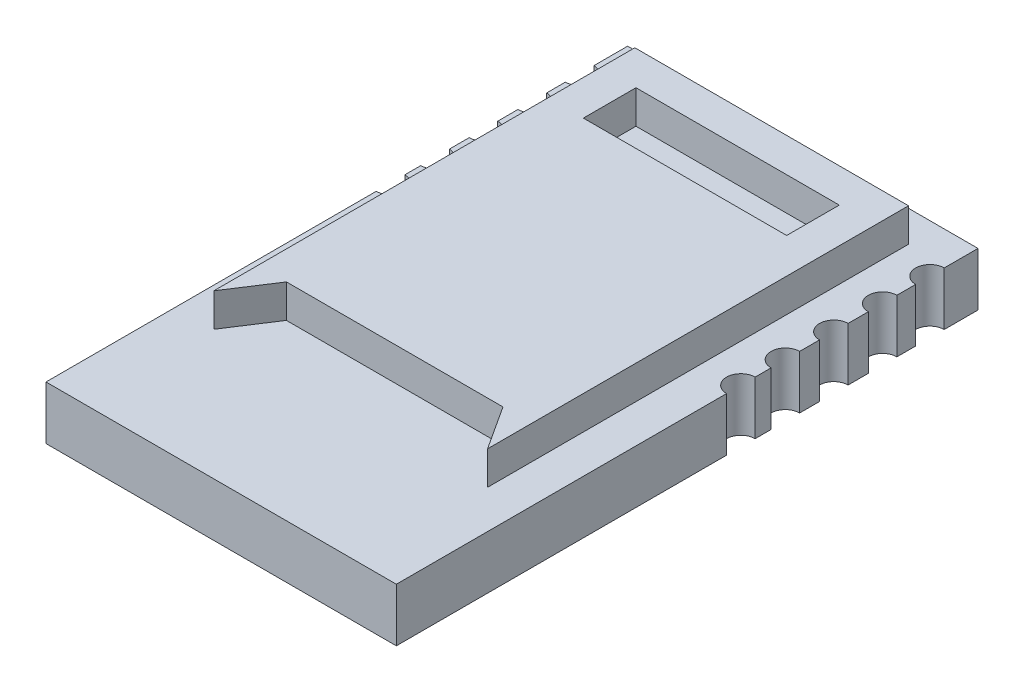
from build123d import *

# Parameters (mm, degrees)
BOSS_EXTRUDE1_DEPTH = 8
SKETCH2_W           = 30.471838297
SKETCH2_H           = 7.887355033
BOSS_EXTRUDE2_DEPTH = 13


with BuildPart() as part:
    # Sketch1 → Boss-Extrude1 (new body)
    with BuildSketch(Plane(origin=(0, 0, 0), x_dir=(1, 0, 0), z_dir=(0, 1, 0))):
        with BuildLine():
            Line((5.74475938, 41.611912647), (-46.770116697, 41.611912647))
            Line((-46.770116697, 41.611912647), (-46.770116697, 36.54735623))
            ThreePointArc((-46.770116697, 36.54735623), (-44.629147114, 34.406386647), (-46.770116697, 32.265417064))
            Line((-46.770116697, 32.265417064), (-46.770116697, 29.455346126))
            ThreePointArc((-46.770116697, 29.455346126), (-44.629147114, 27.314376543), (-46.770116697, 25.173406959))
            Line((-46.770116697, 25.173406959), (-46.770116697, 22.138808466))
            ThreePointArc((-46.770116697, 22.138808466), (-44.629147114, 19.997838883), (-46.770116697, 17.8568693))
            Line((-46.770116697, 17.8568693), (-46.770116697, 14.877282368))
            ThreePointArc((-46.770116697, 14.877282368), (-44.629147114, 12.736312785), (-46.770116697, 10.595343202))
            Line((-46.770116697, 10.595343202), (-46.770116697, 8.20529307))
            ThreePointArc((-46.770116697, 8.20529307), (-44.629147114, 6.064323487), (-46.770116697, 3.923353904))
            Line((-46.770116697, 3.923353904), (-46.770116697, -45.574951946))
            Line((-46.770116697, -45.574951946), (5.74475938, -45.574951946))
            Line((5.74475938, -45.574951946), (5.74475938, 3.923353904))
            ThreePointArc((5.74475938, 3.923353904), (3.603789797, 6.064323487), (5.74475938, 8.20529307))
            Line((5.74475938, 8.20529307), (5.74475938, 10.595343202))
            ThreePointArc((5.74475938, 10.595343202), (3.603789797, 12.736312785), (5.74475938, 14.877282368))
            Line((5.74475938, 14.877282368), (5.74475938, 17.8568693))
            ThreePointArc((5.74475938, 17.8568693), (3.603789797, 19.997838883), (5.74475938, 22.138808466))
            Line((5.74475938, 22.138808466), (5.74475938, 25.173406959))
            ThreePointArc((5.74475938, 25.173406959), (3.603789797, 27.314376543), (5.74475938, 29.455346126))
            Line((5.74475938, 29.455346126), (5.74475938, 32.265417064))
            ThreePointArc((5.74475938, 32.265417064), (3.603789797, 34.406386647), (5.74475938, 36.54735623))
            Line((5.74475938, 36.54735623), (5.74475938, 41.611912647))
        make_face()
    extrude(amount=BOSS_EXTRUDE1_DEPTH)

    # Sketch2 → Boss-Extrude2 (add)
    with BuildSketch(Plane(origin=(0, 0, 0), x_dir=(1, 0, 0), z_dir=(0, 1, 0))):
        Polygon((-41.025357317, 36.942692964), (-41.025357317, -26.156147295), (-36.740368518, -19.565642265), (-4.284988799, -19.565642265), (0, -26.156147295), (0, 36.942692964), align=None)
        with Locations((-20.512678659, 27.89543278)):
            Rectangle(SKETCH2_W, SKETCH2_H, mode=Mode.SUBTRACT)
    extrude(amount=BOSS_EXTRUDE2_DEPTH)


solid = part.part
